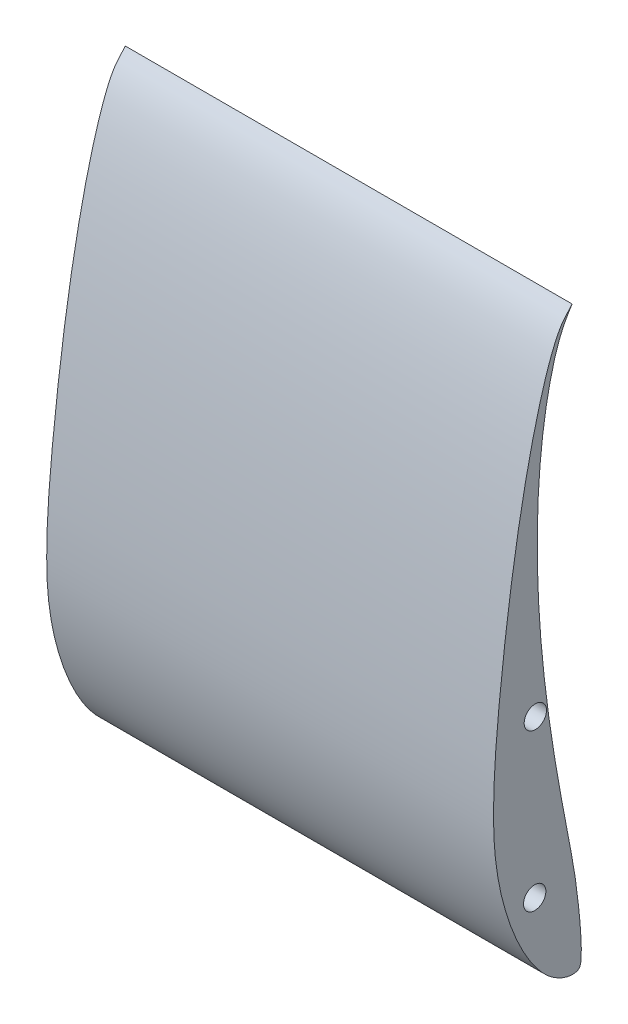
from build123d import *

# Parameters (mm, degrees)
SKETCH3_R           = 5
BOSS_EXTRUDE2_DEPTH = 200


with BuildPart() as part:
    # Sketch3 → Boss-Extrude2 (new body)
    with BuildSketch(Plane(origin=(0, 0, 0), x_dir=(0, 0, -1), z_dir=(1, 0, 0))):
        with BuildLine():
            add(Edge.make_bspline(
                [(0, 260), (-0.006618871, 260.001556519), (-0.643440163, 259.146840985), (-1.352683305, 258.423988878), (-2.83407728, 256.818965203), (-4.409997202, 254.925412529), (-5.998699826, 252.335195115), (-7.538332271, 249.114240072), (-9.145125215, 245.2257893), (-10.796705552, 240.675769941), (-12.481406093, 235.485409192), (-14.184599624, 229.681652027), (-15.898292171, 223.296997869), (-17.606748763, 216.366700019), (-19.297601966, 208.930491682), (-20.960290721, 201.032694495), (-22.586267538, 192.721536069), (-24.155523812, 184.045591395), (-25.665817526, 175.059494526), (-27.097700743, 165.815033056), (-28.453969497, 156.371991155), (-29.723876035, 146.790887452), (-30.903356723, 137.141117923), (-32.000762927, 127.499825157), (-32.988404252, 117.946824698), (-33.847795868, 108.559943379), (-34.530566521, 99.405200851), (-35.000225101, 90.534892364), (-35.203045559, 81.998366344), (-35.181456646, 73.839354201), (-34.781967556, 66.073075647), (-33.972420911, 58.696522239), (-32.82770995, 51.679665679), (-31.344747006, 45.020812441), (-29.605766091, 38.726803527), (-27.64156722, 32.824269665), (-25.498083254, 27.338313788), (-23.186798193, 22.303026269), (-20.754637774, 17.734555035), (-18.229260357, 13.65775407), (-15.644886998, 10.098189416), (-13.056296617, 7.057329744), (-10.435232805, 4.579272863), (-7.80439403, 2.675809098), (-5.244938266, 1.269768355), (-2.814856282, 0.368645037), (-0.571891344, -0.060740267), (1.32512535, 0.022142717), (3.064995336, 0.510537061), (3.928679543, 2.325977045), (4.049851717, 4.76685994), (4.167292265, 8.105978641), (3.986214917, 12.305156067), (3.653449934, 17.316933219), (3.12043259, 23.085534249), (2.399237205, 29.551930382), (1.474388229, 36.684589771), (0.181774172, 44.480026792), (-1.439142903, 52.976196758), (-3.20321793, 62.2155748), (-5.065828248, 72.152999592), (-6.94966285, 82.726053655), (-8.784023632, 93.857088102), (-10.507656487, 105.459747593), (-12.057332363, 117.434040945), (-13.387928437, 129.67228669), (-14.439709845, 142.058878738), (-15.185293174, 154.469514585), (-15.595181628, 166.774534946), (-15.646953476, 178.840451941), (-15.337091064, 190.532651369), (-14.672848331, 201.717250621), (-13.662795797, 212.259756474), (-12.345704215, 222.034654083), (-10.759790618, 230.914677413), (-8.958169218, 238.79571212), (-7.030354058, 245.532514357), (-4.97282329, 251.045892225), (-3.089919221, 254.979545411), (-1.348922874, 257.879722894), (-0.675186007, 258.993846371), (0.006753432, 259.998411837), (0, 260)],
                knots=[0, 0, 0, 0, 0.000979678, 0.003648862, 0.007483499, 0.012095277, 0.017525591, 0.02405178, 0.031783051, 0.040677828, 0.050710301, 0.061833229, 0.07398925, 0.087118173, 0.101145049, 0.115990637, 0.131570422, 0.147788379, 0.164550917, 0.181757895, 0.199311955, 0.217095072, 0.234990228, 0.252856883, 0.270540594, 0.287886779, 0.304773438, 0.321101419, 0.336806063, 0.351800033, 0.366031063, 0.379615675, 0.392652963, 0.405170359, 0.417171919, 0.428603517, 0.439418959, 0.449596586, 0.459102079, 0.467907878, 0.475988301, 0.483308969, 0.489874508, 0.49580325, 0.501149412, 0.505903073, 0.510046769, 0.513579311, 0.516446927, 0.519350053, 0.523823355, 0.529973794, 0.537715654, 0.546967844, 0.557637367, 0.569620481, 0.582804124, 0.597246961, 0.613135037, 0.6304436, 0.649056124, 0.668822257, 0.689594964, 0.711189651, 0.733426689, 0.756094118, 0.778988554, 0.801889683, 0.824566598, 0.846792285, 0.868338291, 0.888978163, 0.908492011, 0.926658768, 0.943286193, 0.95816921, 0.971135822, 0.981955623, 0.990251791, 0.995852565, 0.999000406, 1, 1, 1, 1], degree=3))
        make_face()
        with Locations((-16.740866277, 38.231892945)):
            Circle(SKETCH3_R, mode=Mode.SUBTRACT)
        with Locations((-16.449006835, 108.231892945)):
            Circle(SKETCH3_R, mode=Mode.SUBTRACT)
    extrude(amount=BOSS_EXTRUDE2_DEPTH)


solid = part.part
